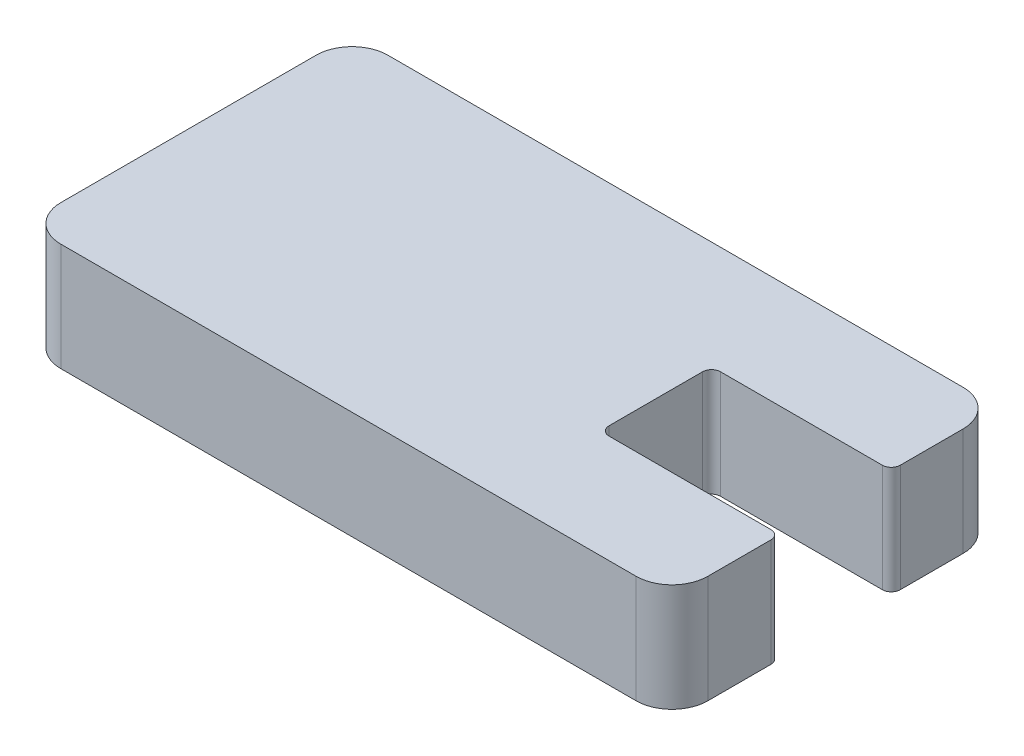
from build123d import *

# Parameters (mm, degrees)
SALIENTE_EXTRUIR1_DEPTH = 3
REDONDEO1_R             = 0.25


with BuildPart() as part:
    # Croquis1 → Saliente-Extruir1 (new body)
    with BuildSketch(Plane(origin=(0, 0, 0), x_dir=(1, 0, 0), z_dir=(0, 1, 0))):
        with BuildLine():
            Line((0, 3.55), (0, -3.55))
            ThreePointArc((0, -3.55), (0.292893219, -4.257106781), (1, -4.55))
            Line((1, -4.55), (17, -4.55))
            ThreePointArc((17, -4.55), (17.707106781, -4.257106781), (18, -3.55))
            Line((18, -3.55), (18, -1.55))
            Line((18, -1.55), (13, -1.55))
            Line((13, -1.55), (13, 1.55))
            Line((13, 1.55), (18, 1.55))
            Line((18, 1.55), (18, 3.55))
            ThreePointArc((18, 3.55), (17.707106781, 4.257106781), (17, 4.55))
            Line((17, 4.55), (1, 4.55))
            ThreePointArc((1, 4.55), (0.292893219, 4.257106781), (0, 3.55))
        make_face()
    extrude(amount=SALIENTE_EXTRUIR1_DEPTH)

    # Redondeo1
    redondeo1_edges = [part.edges().sort_by_distance(p)[0] for p in [
        (18, 1.5, -1.55),
        (13, 1.5, -1.55),
        (13, 1.5, 1.55),
        (18, 1.5, 1.55),
    ]]
    fillet(redondeo1_edges, radius=REDONDEO1_R)


solid = part.part
